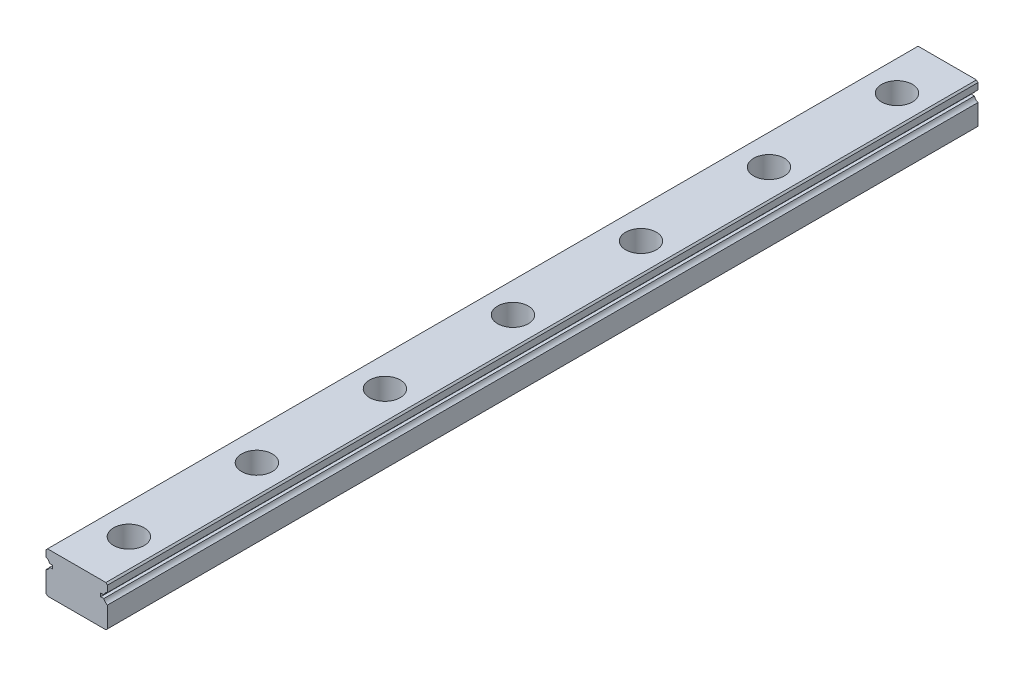
from build123d import *

# Parameters (mm, degrees)
EXTRUDE_1_DEPTH        = 170
SKETCH_2_R             = 3
SKETCH_2_R_2           = 1.75
CUT_EXTRUDE_1_DEPTH    = 4.5
SKETCH_2_2_R           = 1.75
CUT_EXTRUDE_2_DEPTH    = 171.293863659
PATTERN_LINEAR_1_COUNT = 12
PATTERN_LINEAR_1_PITCH = 25


with BuildPart() as part:
    # Эскиз1 → Бобышка-Вытянуть1 (new body)
    with BuildSketch(Plane.XY):
        with BuildLine():
            Line((-6, 3.7), (-5.7, 4))
            Line((-5.7, 4), (5.7, 4))
            Line((5.7, 4), (6, 3.7))
            Line((6, 3.7), (6, 2.449776022))
            ThreePointArc((6, 2.449776022), (5.561887715, 2.168810579), (5.297911886, 1.720256551))
            Line((5.297911886, 1.720256551), (4.687472904, 1.720256551))
            Line((4.687472904, 1.720256551), (4.687472904, 1.082255421))
            Line((4.687472904, 1.082255421), (5.292171789, 1.082255421))
            ThreePointArc((5.292171789, 1.082255421), (5.554928022, 0.621665058), (6, 0.333402583))
            Line((6, 0.333402583), (6, -3.7))
            Line((6, -3.7), (5.7, -4))
            Line((5.7, -4), (-5.7, -4))
            Line((-5.7, -4), (-6, -3.7))
            Line((-6, -3.7), (-6, 0.333402583))
            ThreePointArc((-6, 0.333402583), (-5.554928022, 0.621665058), (-5.292171789, 1.082255421))
            Line((-5.292171789, 1.082255421), (-4.687472904, 1.082255421))
            Line((-4.687472904, 1.082255421), (-4.687472904, 1.720256551))
            Line((-4.687472904, 1.720256551), (-5.297911886, 1.720256551))
            ThreePointArc((-5.297911886, 1.720256551), (-5.561887715, 2.168810579), (-6, 2.449776022))
            Line((-6, 2.449776022), (-6, 3.7))
        make_face()
    extrude(amount=EXTRUDE_1_DEPTH)

    # Эскиз2 → Вырез-Вытянуть1 (cut)
    with BuildSketch(Plane(origin=(0, 4, 0), x_dir=(1, 0, 0), z_dir=(0, 1, 0))):
        with Locations((0.188190244, -10)):
            Circle(SKETCH_2_R)
        with Locations((0.188190244, -10)):
            Circle(SKETCH_2_R_2, mode=Mode.SUBTRACT)
    cut_extrude_1 = extrude(amount=-CUT_EXTRUDE_1_DEPTH, mode=Mode.SUBTRACT)

    # Эскиз2<2> → Вырез-Вытянуть2 (cut, through all)
    with BuildSketch(Plane(origin=(0, 4, 0), x_dir=(1, 0, 0), z_dir=(0, 1, 0))):
        with Locations((0.188190244, -10)):
            Circle(SKETCH_2_2_R)
    cut_extrude_2 = extrude(amount=-CUT_EXTRUDE_2_DEPTH, mode=Mode.SUBTRACT)

    # Линейный массив1: Вырез-Вытянуть1, Вырез-Вытянуть2 ×12
    with Locations(*[(0, 0, i * PATTERN_LINEAR_1_PITCH) for i in range(1, PATTERN_LINEAR_1_COUNT)]):
        add(cut_extrude_1, mode=Mode.SUBTRACT)
        add(cut_extrude_2, mode=Mode.SUBTRACT)


solid = part.part
